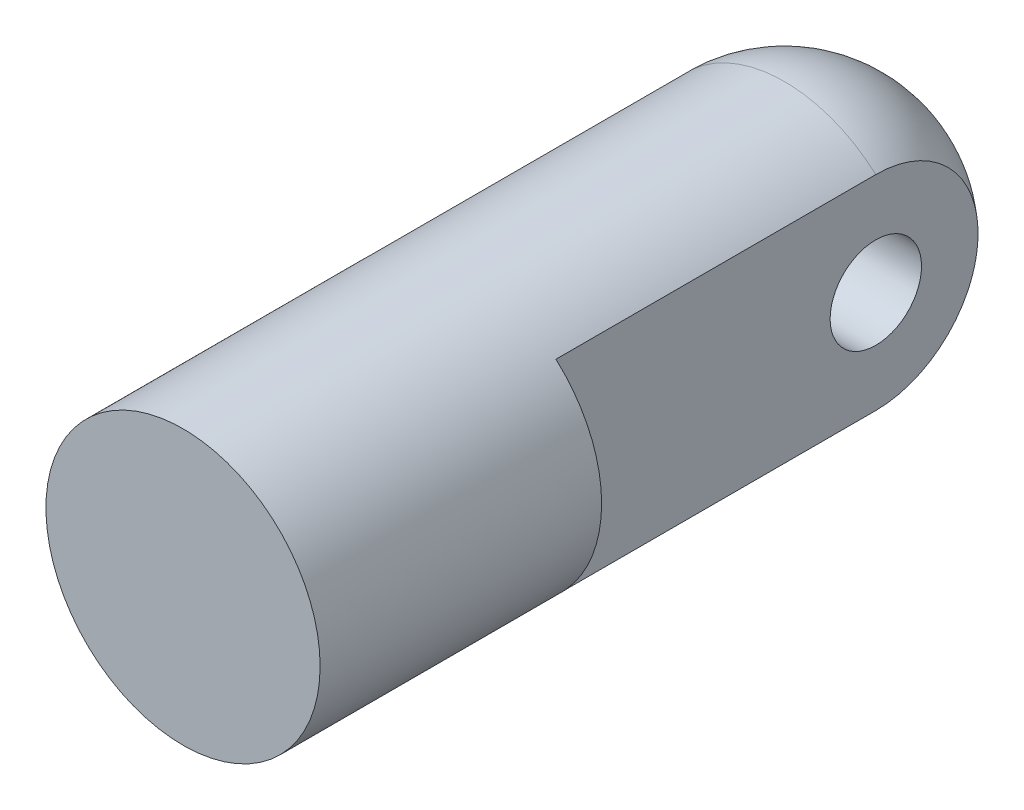
from build123d import *

# Parameters (mm, degrees)
SKETCH2_W           = 12.7
SKETCH2_H           = 60.004179461
CUT_EXTRUDE1_DEPTH  = 41.411152545
SKETCH3_R           = 3.175
CUT_EXTRUDE2_DEPTH  = 43.359783404
BOSS_EXTRUDE2_START = 13.208
SKETCH11_R          = 9.525
BOSS_EXTRUDE2_DEPTH = 13.208


with BuildPart() as part:
    # Sketch1 → Revolve1 (revolve)
    with BuildSketch(Plane(origin=(0, 0, 0), x_dir=(1, 0, 0), z_dir=(0, 1, 0)), mode=Mode.PRIVATE) as revolve1_sk:
        with BuildLine():
            Line((0, 0), (0, 28.575))
            Line((0, 28.575), (0, 38.1))
            ThreePointArc((0, 38.1), (6.735192091, 35.310192091), (9.525, 28.575))
            Line((9.525, 28.575), (9.525, 0))
            Line((9.525, 0), (0, 0))
        make_face()
    revolve(revolve1_sk.sketch.rotate(Axis((0, 0, -38.1), (0, 0, 1)), 180), axis=Axis((0, 0, -38.1), (0, 0, 1)))

    # Sketch2 → Cut-Extrude1 (cut, symmetric)
    with BuildSketch(Plane(origin=(0, 0, 0), x_dir=(1, 0, 0), z_dir=(0, 1, 0))):
        with Locations((-12.7, 36.35208973)):
            Rectangle(SKETCH2_W, SKETCH2_H)
    cut_extrude1 = extrude(amount=CUT_EXTRUDE1_DEPTH, both=True, mode=Mode.SUBTRACT)

    # Mirror1: Cut-Extrude1 across plane
    add(cut_extrude1.mirror(Plane(origin=(0, 0, 0), x_dir=(0, 0, 1), z_dir=(1, 0, 0))), mode=Mode.SUBTRACT)

    # Sketch3 → Cut-Extrude2 (cut, through all)
    with BuildSketch(Plane.ZY.offset(6.35)):
        with Locations((-28.575, 0)):
            Circle(SKETCH3_R)
    extrude(amount=-CUT_EXTRUDE2_DEPTH, mode=Mode.SUBTRACT)

    # Sketch11 → Boss-Extrude2 (add)
    with BuildSketch(Plane.XY.offset(BOSS_EXTRUDE2_START)):
        with Locations(Location((0, 0, 0), (0, 0, 131.810314896))):
            Circle(SKETCH11_R)
    extrude(amount=-BOSS_EXTRUDE2_DEPTH)


solid = part.part
